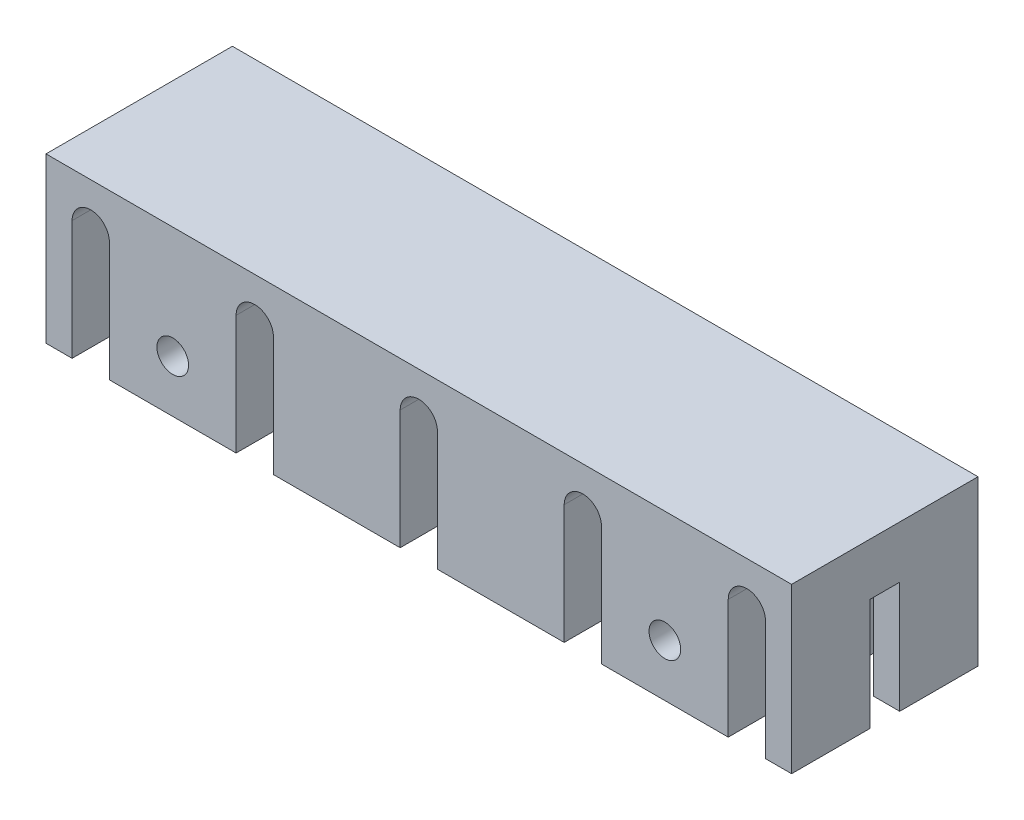
from build123d import *

# Parameters (mm, degrees)
SKETCH1_W           = 100
SKETCH1_H           = 25
BOSS_EXTRUDE1_DEPTH = 25
CUT_EXTRUDE1_DEPTH  = 48
SKETCH3_W           = 4
SKETCH3_H           = 18
CUT_EXTRUDE2_DEPTH  = 104.832798286
SKETCH4_R           = 2.122448424
CUT_EXTRUDE3_DEPTH  = 62.23724357
SKETCH5_W           = 100
SKETCH5_H           = 3
CUT_EXTRUDE4_DEPTH  = 62.23724357


with BuildPart() as part:
    # Sketch1 → Boss-Extrude1 (new body)
    with BuildSketch(Plane(origin=(0, 0, 0), x_dir=(1, 0, 0), z_dir=(0, 1, 0))):
        Rectangle(SKETCH1_W, SKETCH1_H)
    extrude(amount=BOSS_EXTRUDE1_DEPTH)

    # Sketch2 → Cut-Extrude1 (cut)
    with BuildSketch(Plane.XY.offset(12.5)):
        with BuildLine():
            Line((-19.5, 19), (-19.5, 0))
            Line((-19.5, 0), (-24.5, 0))
            Line((-24.5, 0), (-24.5, 19))
            ThreePointArc((-24.5, 19), (-22, 21.5), (-19.5, 19))
        make_face()
        with BuildLine():
            Line((-46.5, 19), (-46.5, 0))
            Line((-46.5, 0), (-41.5, 0))
            Line((-41.5, 0), (-41.5, 19))
            ThreePointArc((-41.5, 19), (-44, 21.5), (-46.5, 19))
        make_face()
        with BuildLine():
            Line((2.5, 19), (2.5, 0))
            Line((2.5, 0), (-2.5, 0))
            Line((-2.5, 0), (-2.5, 19))
            ThreePointArc((-2.5, 19), (0, 21.5), (2.5, 19))
        make_face()
        with BuildLine():
            Line((24.5, 19), (24.5, 0))
            Line((24.5, 0), (19.5, 0))
            Line((19.5, 0), (19.5, 19))
            ThreePointArc((19.5, 19), (22, 21.5), (24.5, 19))
        make_face()
        with BuildLine():
            Line((46.5, 19), (46.5, 0))
            Line((46.5, 0), (41.5, 0))
            Line((41.5, 0), (41.5, 19))
            ThreePointArc((41.5, 19), (44, 21.5), (46.5, 19))
        make_face()
    extrude(amount=-CUT_EXTRUDE1_DEPTH, mode=Mode.SUBTRACT)

    # Sketch3 → Cut-Extrude2 (cut, through all)
    with BuildSketch(Plane.ZY.offset(50)):
        with Locations((0, 9)):
            Rectangle(SKETCH3_W, SKETCH3_H)
    extrude(amount=-CUT_EXTRUDE2_DEPTH, mode=Mode.SUBTRACT)

    # Sketch4 → Cut-Extrude3 (cut, through all)
    with BuildSketch(Plane.XY.offset(12.5)):
        with Locations((-33, 10)):
            Circle(SKETCH4_R)
        with Locations(Location((33, 10, 0), (0, 0, 270))):
            Circle(SKETCH4_R)
    extrude(amount=-CUT_EXTRUDE3_DEPTH, mode=Mode.SUBTRACT)

    # Sketch5 → Cut-Extrude4 (cut, through all)
    with BuildSketch(Plane.XY.offset(12.5)):
        with Locations((0, 1.5)):
            Rectangle(SKETCH5_W, SKETCH5_H)
    extrude(amount=-CUT_EXTRUDE4_DEPTH, mode=Mode.SUBTRACT)


solid = part.part
